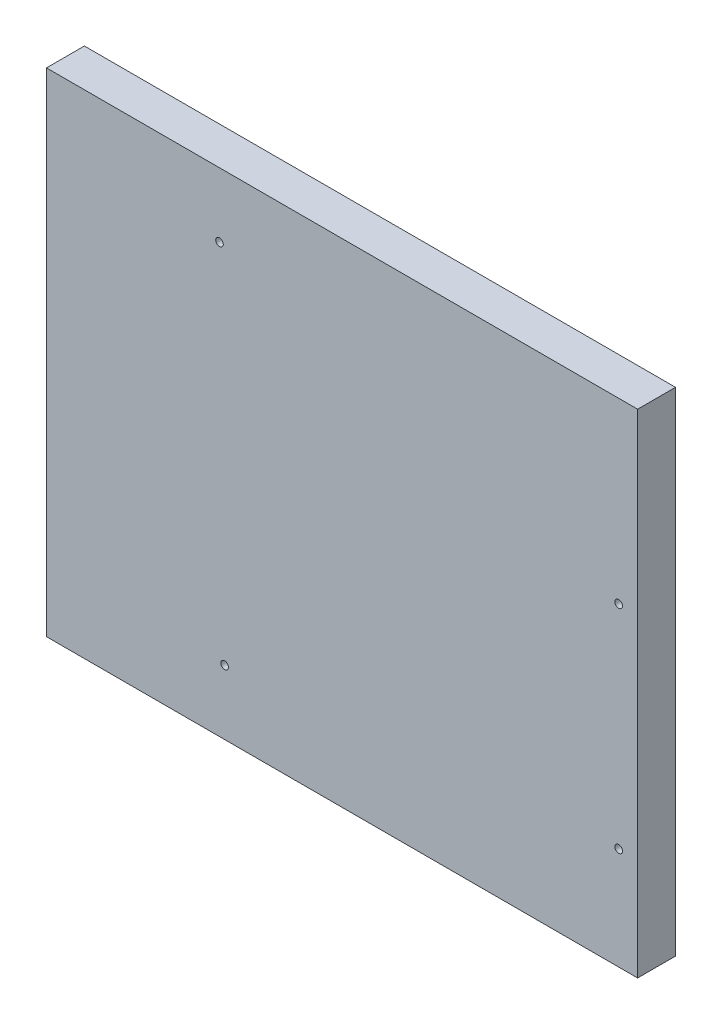
from build123d import *

# Parameters (mm, degrees)
CROQUIS1_W              = 78
CROQUIS1_H              = 65
SALIENTE_EXTRUIR2_DEPTH = 5
CROQUIS3_R              = 0.5
CORTAR_EXTRUIR1_DEPTH   = 21


with BuildPart() as part:
    # Croquis1 → Saliente-Extruir2 (new body)
    with BuildSketch(Plane.XY):
        with Locations((39, 32.5)):
            Rectangle(CROQUIS1_W, CROQUIS1_H)
    extrude(amount=SALIENTE_EXTRUIR2_DEPTH)

    # Croquis3 → Cortar-Extruir1 (cut)
    with BuildSketch(Plane.XY.offset(5)):
        with Locations((22.827220923, 56.5)):
            Circle(CROQUIS3_R)
        with Locations((23.5, 8.5)):
            Circle(CROQUIS3_R)
        with Locations((75.5, 13.5)):
            Circle(CROQUIS3_R)
        with Locations((75.5, 41.5)):
            Circle(CROQUIS3_R)
    extrude(amount=-CORTAR_EXTRUIR1_DEPTH, mode=Mode.SUBTRACT)


solid = part.part
